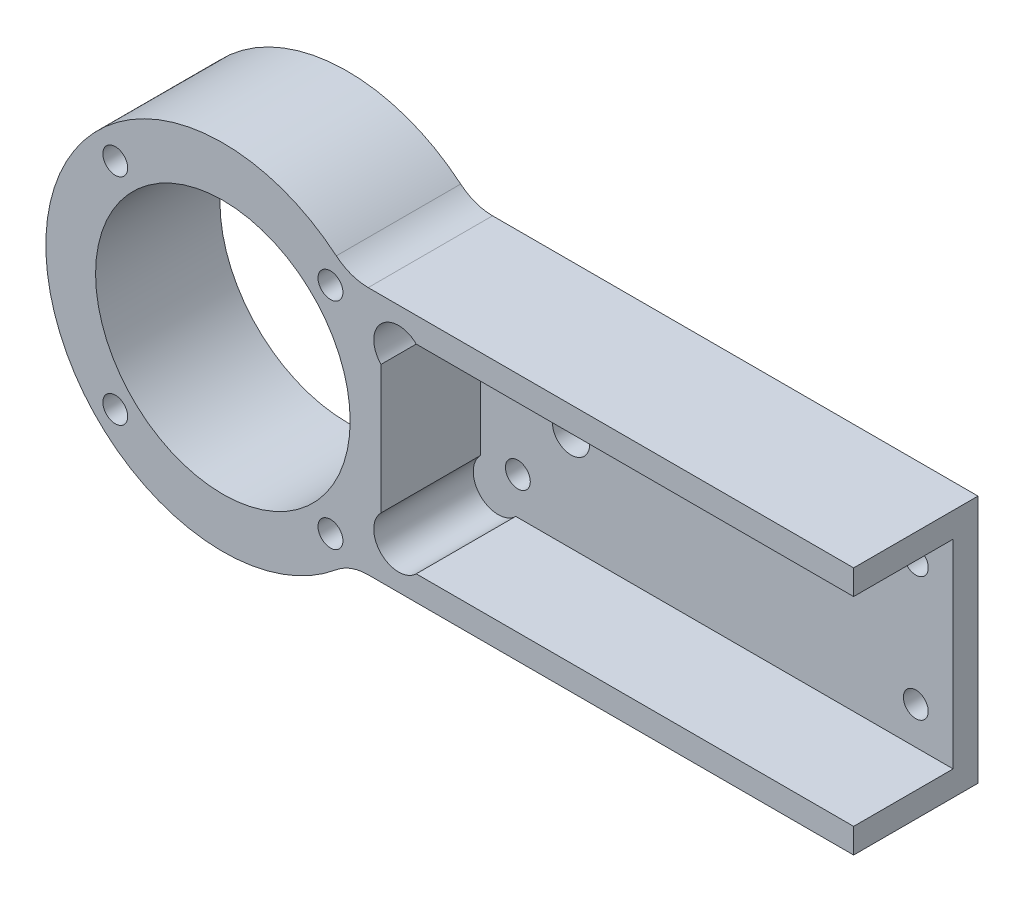
from build123d import *

# Parameters (mm, degrees)
SKETCH1_R               = 32.5
SKETCH1_W               = 120.65
SKETCH1_H               = 50.8
BOSS_EXTRUDE2_DEPTH     = 6.35
BOSS_EXTRUDE3_START     = 6.35
SKETCH1_3_R             = 32.5
BOSS_EXTRUDE3_DEPTH     = 25.4
CUT_EXTRUDE1_DEPTH      = 170.176810751
CUT_EXTRUDE1_DEPTH_BACK = 170.176810751
SKETCH2_R               = 3.175
SKETCH3_R               = 6.35
CUT_EXTRUDE2_DEPTH      = 25.4
SKETCH4_3_R             = 4.7625
CUT_EXTRUDE3_DEPTH      = 6.35
FILLET1_R               = 12.7


with BuildPart() as part:
    # Sketch1 → Boss-Extrude2 (new body)
    # profile 1 of 2: a face of its own
    with BuildSketch(Plane.XY):
        with BuildLine():
            Line((32.171066193, 31.75), (161.036, 31.75))
            Line((161.036, 31.75), (161.036, 25.4))
            Line((161.036, 25.4), (40.386, 25.4))
            Line((40.386, 25.4), (40.386, -25.4))
            Line((40.386, -25.4), (161.036, -25.4))
            Line((161.036, -25.4), (161.036, -31.75))
            Line((161.036, -31.75), (32.171066193, -31.75))
            ThreePointArc((32.171066193, -31.75), (-45.2, 0), (32.171066193, 31.75))
        make_face()
        Circle(SKETCH1_R, mode=Mode.SUBTRACT)
    # profile 2 of 2: a face of its own
    with BuildSketch(Plane.XY):
        with Locations((100.711, 0)):
            Rectangle(SKETCH1_W, SKETCH1_H)
    extrude(amount=BOSS_EXTRUDE2_DEPTH)

    # Sketch1<3> → Boss-Extrude3 (add)
    with BuildSketch(Plane.XY.offset(BOSS_EXTRUDE3_START)):
        with BuildLine():
            Line((32.171066193, 31.75), (161.036, 31.75))
            Line((161.036, 31.75), (161.036, 25.4))
            Line((161.036, 25.4), (40.386, 25.4))
            Line((40.386, 25.4), (40.386, -25.4))
            Line((40.386, -25.4), (161.036, -25.4))
            Line((161.036, -25.4), (161.036, -31.75))
            Line((161.036, -31.75), (32.171066193, -31.75))
            ThreePointArc((32.171066193, -31.75), (-45.2, 0), (32.171066193, 31.75))
        make_face()
        Circle(SKETCH1_3_R, mode=Mode.SUBTRACT)
    extrude(amount=BOSS_EXTRUDE3_DEPTH)

    # Sketch2 → Cut-Extrude1 (cut, two sides: drawn at the far end of the back side and taken through both)
    with BuildSketch(Plane.XY.offset(6.35).offset(-CUT_EXTRUDE1_DEPTH_BACK)):
        with Locations((49.911, 15.875)):
            Circle(SKETCH2_R)
        with Locations((151.511, 15.875)):
            Circle(SKETCH2_R)
        with Locations((151.511, -15.875)):
            Circle(SKETCH2_R)
        with Locations((49.911, -15.875)):
            Circle(SKETCH2_R)
        with Locations((27.471098449, 27.471098449)):
            Circle(SKETCH2_R)
        with Locations((27.471098449, -27.471098449)):
            Circle(SKETCH2_R)
        with Locations((-27.471098449, -27.471098449)):
            Circle(SKETCH2_R)
        with Locations((-27.471098449, 27.471098449)):
            Circle(SKETCH2_R)
    extrude(amount=CUT_EXTRUDE1_DEPTH + CUT_EXTRUDE1_DEPTH_BACK, mode=Mode.SUBTRACT)

    # Sketch3 → Cut-Extrude2 (cut)
    with BuildSketch(Plane.XY.offset(31.75)):
        with Locations((44.876128061, 20.909871939)):
            Circle(SKETCH3_R)
        with Locations((44.876128061, -20.909871939)):
            Circle(SKETCH3_R)
    extrude(amount=-CUT_EXTRUDE2_DEPTH, mode=Mode.SUBTRACT)

    # Sketch4<3> → Cut-Extrude3 (cut)
    with BuildSketch(Plane(origin=(0, 0, 0), x_dir=(-1, 0, 0), z_dir=(0, 0, -1))):
        with Locations((-63.5, 0)):
            Circle(SKETCH4_3_R)
    extrude(amount=-CUT_EXTRUDE3_DEPTH, mode=Mode.SUBTRACT)

    # Fillet1
    fillet1_edges = [part.edges().sort_by_distance(p)[0] for p in [
        (32.171066193, -31.75, 15.875),
        (32.171066193, 31.75, 15.875),
    ]]
    fillet(fillet1_edges, radius=FILLET1_R)


solid = part.part
